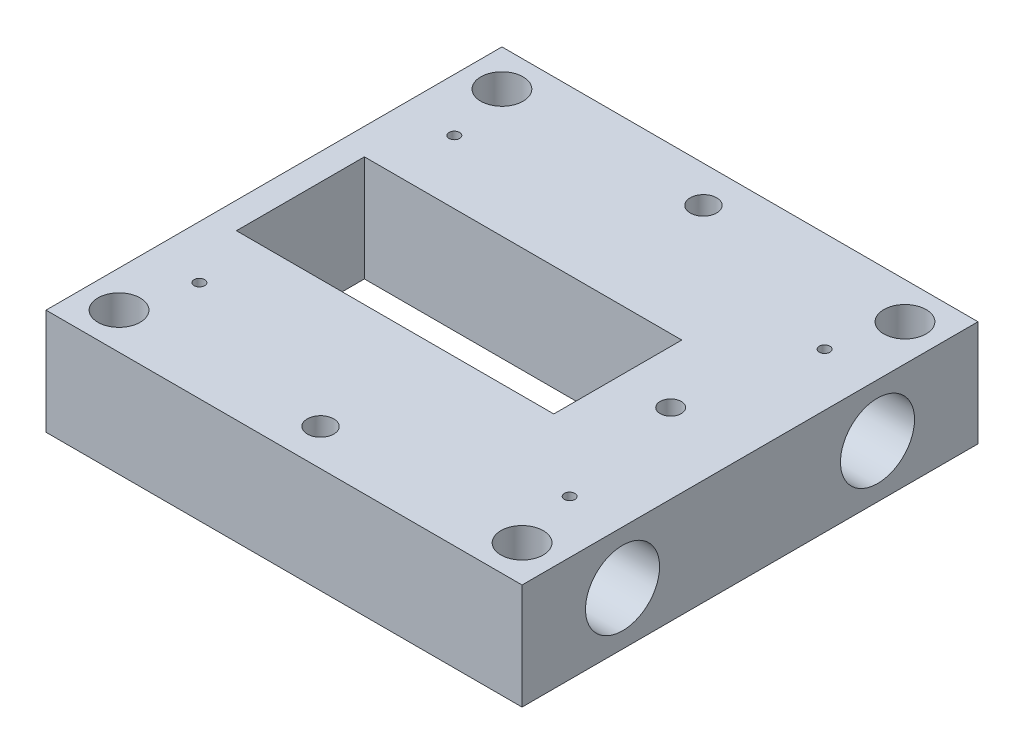
from build123d import *

# Parameters (mm, degrees)
SKETCH2_W           = 86.2
SKETCH2_H           = 20
SKETCH2_R           = 7
BOSS_EXTRUDE1_DEPTH = 45
SKETCH3_R           = 1.375
CUT_EXTRUDE1_DEPTH  = 66.441653402
SKETCH4_R           = 4
CUT_EXTRUDE2_DEPTH  = 17
SKETCH5_R           = 7
SKETCH5_R_2         = 5
BOSS_EXTRUDE2_DEPTH = 21
SKETCH6_R           = 2
SKETCH6_R_2         = 2.5
CUT_EXTRUDE3_DEPTH  = 66.441653402
SKETCH7_R           = 5
CUT_EXTRUDE4_DEPTH  = 16
CUT_EXTRUDE5_REACH  = 67.442
SKETCH8_R           = 1
SKETCH9_W           = 60
SKETCH9_H           = 24.2
CUT_EXTRUDE6_DEPTH  = 66.441653471


with BuildPart() as part:
    # Sketch2 → Boss-Extrude1 (new, symmetric)
    with BuildSketch(Plane(origin=(0, 0, 0), x_dir=(0, 0, -1), z_dir=(1, 0, 0))):
        Rectangle(SKETCH2_W, SKETCH2_H)
        with Locations(Location((-24.1, 0, 0), (0, 0, 180))):
            Circle(SKETCH2_R, mode=Mode.SUBTRACT)
        with Locations(Location((24.1, 0, 0), (0, 0, 180))):
            Circle(SKETCH2_R, mode=Mode.SUBTRACT)
    extrude(amount=BOSS_EXTRUDE1_DEPTH, both=True)

    # Sketch3 → Cut-Extrude1 (cut, through all)
    with BuildSketch(Plane.XZ.offset(10)):
        with Locations(Location((-38.1, 36.195, 0), (0, 0, 270))):
            Circle(SKETCH3_R)
        with Locations(Location((38.1, 36.195, 0), (0, 0, 270))):
            Circle(SKETCH3_R)
        with Locations(Location((38.1, -36.195, 0), (0, 0, 270))):
            Circle(SKETCH3_R)
        with Locations(Location((-38.1, -36.195, 0), (0, 0, 270))):
            Circle(SKETCH3_R)
    extrude(amount=-CUT_EXTRUDE1_DEPTH, mode=Mode.SUBTRACT)

    # Sketch4 → Cut-Extrude2 (cut)
    with BuildSketch(Plane(origin=(0, 10, 0), x_dir=(1, 0, 0), z_dir=(0, 1, 0))):
        with Locations(Location((-38.1, -36.195, 0), (0, 0, 270))):
            Circle(SKETCH4_R)
        with Locations(Location((-38.1, 36.195, 0), (0, 0, 270))):
            Circle(SKETCH4_R)
        with Locations(Location((38.1, 36.195, 0), (0, 0, 270))):
            Circle(SKETCH4_R)
        with Locations(Location((38.1, -36.195, 0), (0, 0, 270))):
            Circle(SKETCH4_R)
    extrude(amount=-CUT_EXTRUDE2_DEPTH, mode=Mode.SUBTRACT)

    # Sketch5 → Boss-Extrude2 (add, symmetric)
    # profile 1 of 2: a face of its own
    with BuildSketch(Plane(origin=(0, 0, 0), x_dir=(0, 0, -1), z_dir=(1, 0, 0))):
        with Locations(Location((24.1, 0, 0), (0, 0, 180))):
            Circle(SKETCH5_R)
        with Locations(Location((24.1, 0, 0), (0, 0, 180))):
            Circle(SKETCH5_R_2, mode=Mode.SUBTRACT)
    # profile 2 of 2: a face of its own
    with BuildSketch(Plane(origin=(0, 0, 0), x_dir=(0, 0, -1), z_dir=(1, 0, 0))):
        with Locations(Location((-24.1, 0, 0), (0, 0, 180))):
            Circle(SKETCH5_R)
        with Locations(Location((-24.1, 0, 0), (0, 0, 180))):
            Circle(SKETCH5_R_2, mode=Mode.SUBTRACT)
    extrude(amount=BOSS_EXTRUDE2_DEPTH, both=True)

    # Sketch6 → Cut-Extrude3 (cut, through all)
    with BuildSketch(Plane(origin=(0, 10, 0), x_dir=(1, 0, 0), z_dir=(0, 1, 0))):
        with Locations(Location((30, 0, 0), (0, 0, 270))):
            Circle(SKETCH6_R)
        with Locations(Location((0, -36.195, 0), (0, 0, 270))):
            Circle(SKETCH6_R_2)
        with Locations(Location((0, 36.195, 0), (0, 0, 270))):
            Circle(SKETCH6_R_2)
    extrude(amount=-CUT_EXTRUDE3_DEPTH, mode=Mode.SUBTRACT)

    # Sketch7 → Cut-Extrude4 (cut)
    with BuildSketch(Plane.XZ.offset(10)):
        with Locations(Location((30, 0, 0), (0, 0, 270))):
            Circle(SKETCH7_R)
        with Locations(Location((0, 36.195, 0), (0, 0, 270))):
            Circle(SKETCH7_R)
        with Locations(Location((0, -36.195, 0), (0, 0, 270))):
            Circle(SKETCH7_R)
    extrude(amount=-CUT_EXTRUDE4_DEPTH, mode=Mode.SUBTRACT)

    # Sketch8 → Cut-Extrude5 (cut, up to next)
    with BuildSketch(Plane(origin=(0, 10, 0), x_dir=(1, 0, 0), z_dir=(0, 1, 0)), mode=Mode.PRIVATE) as cut_extrude5_sk1:
        with Locations(Location((35, -24.1, 0), (0, 0, 270))):
            Circle(SKETCH8_R)
    cut_extrude5_tool1 = extrude(cut_extrude5_sk1.sketch, amount=-CUT_EXTRUDE5_REACH, mode=Mode.PRIVATE) & part.part
    # Sketch8 → Cut-Extrude5 (cut, up to next)
    with BuildSketch(Plane(origin=(0, 10, 0), x_dir=(1, 0, 0), z_dir=(0, 1, 0)), mode=Mode.PRIVATE) as cut_extrude5_sk2:
        with Locations(Location((-35, -24.1, 0), (0, 0, 270))):
            Circle(SKETCH8_R)
    cut_extrude5_tool2 = extrude(cut_extrude5_sk2.sketch, amount=-CUT_EXTRUDE5_REACH, mode=Mode.PRIVATE) & part.part
    # Sketch8 → Cut-Extrude5 (cut, up to next)
    with BuildSketch(Plane(origin=(0, 10, 0), x_dir=(1, 0, 0), z_dir=(0, 1, 0)), mode=Mode.PRIVATE) as cut_extrude5_sk3:
        with Locations(Location((-35, 24.1, 0), (0, 0, 270))):
            Circle(SKETCH8_R)
    cut_extrude5_tool3 = extrude(cut_extrude5_sk3.sketch, amount=-CUT_EXTRUDE5_REACH, mode=Mode.PRIVATE) & part.part
    # Sketch8 → Cut-Extrude5 (cut, up to next)
    with BuildSketch(Plane(origin=(0, 10, 0), x_dir=(1, 0, 0), z_dir=(0, 1, 0)), mode=Mode.PRIVATE) as cut_extrude5_sk4:
        with Locations(Location((35, 24.1, 0), (0, 0, 270))):
            Circle(SKETCH8_R)
    cut_extrude5_tool4 = extrude(cut_extrude5_sk4.sketch, amount=-CUT_EXTRUDE5_REACH, mode=Mode.PRIVATE) & part.part
    add(cut_extrude5_tool1.solids().sort_by_distance((35, 10, 24.1))[0], mode=Mode.SUBTRACT)
    add(cut_extrude5_tool2.solids().sort_by_distance((-35, 10, 24.1))[0], mode=Mode.SUBTRACT)
    add(cut_extrude5_tool3.solids().sort_by_distance((-35, 10, -24.1))[0], mode=Mode.SUBTRACT)
    add(cut_extrude5_tool4.solids().sort_by_distance((35, 10, -24.1))[0], mode=Mode.SUBTRACT)

    # Sketch9 → Cut-Extrude6 (cut, through all)
    with BuildSketch(Plane(origin=(0, 10, 0), x_dir=(1, 0, 0), z_dir=(0, 1, 0))):
        with Locations((-10, 0)):
            Rectangle(SKETCH9_W, SKETCH9_H)
    extrude(amount=-CUT_EXTRUDE6_DEPTH, mode=Mode.SUBTRACT)


solid = part.part
